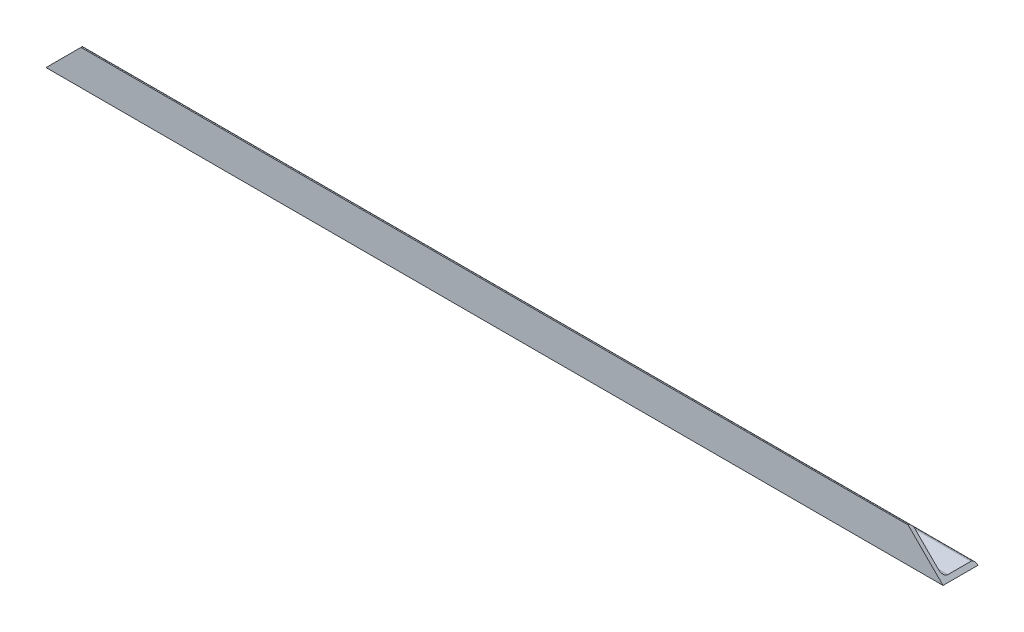
from build123d import *

# Parameters (mm, degrees)
L_ANGLE_EQUAL_60X60X6_4_DEPTH = 1540
CUT_EXTRUDE1_DEPTH            = 1543.335890784


with BuildPart() as part:
    # Sketch17 → L angle (equal) 60X60X6(4) (new body)
    with BuildSketch(Plane(origin=(0, 0, 0), x_dir=(0, 0, -1), z_dir=(1, 0, 0))):
        with BuildLine():
            Line((0, 60), (0, 0))
            Line((0, 0), (60, 0))
            ThreePointArc((60, 0), (58.242640687, 4.242640687), (54, 6))
            Line((54, 6), (14, 6))
            ThreePointArc((14, 6), (8.343145751, 8.343145751), (6, 14))
            Line((6, 14), (6, 54))
            ThreePointArc((6, 54), (4.242640687, 58.242640687), (0, 60))
        make_face()
    extrude(amount=L_ANGLE_EQUAL_60X60X6_4_DEPTH)

    # Sketch14 → Cut-Extrude1 (cut, through all)
    with BuildSketch(Plane.XY):
        Polygon((1540, 0), (1540, 60), (1480, 60), align=None)
        Polygon((0, 60), (0, 0), (60, 60), align=None)
    extrude(amount=-CUT_EXTRUDE1_DEPTH, mode=Mode.SUBTRACT)


solid = part.part
